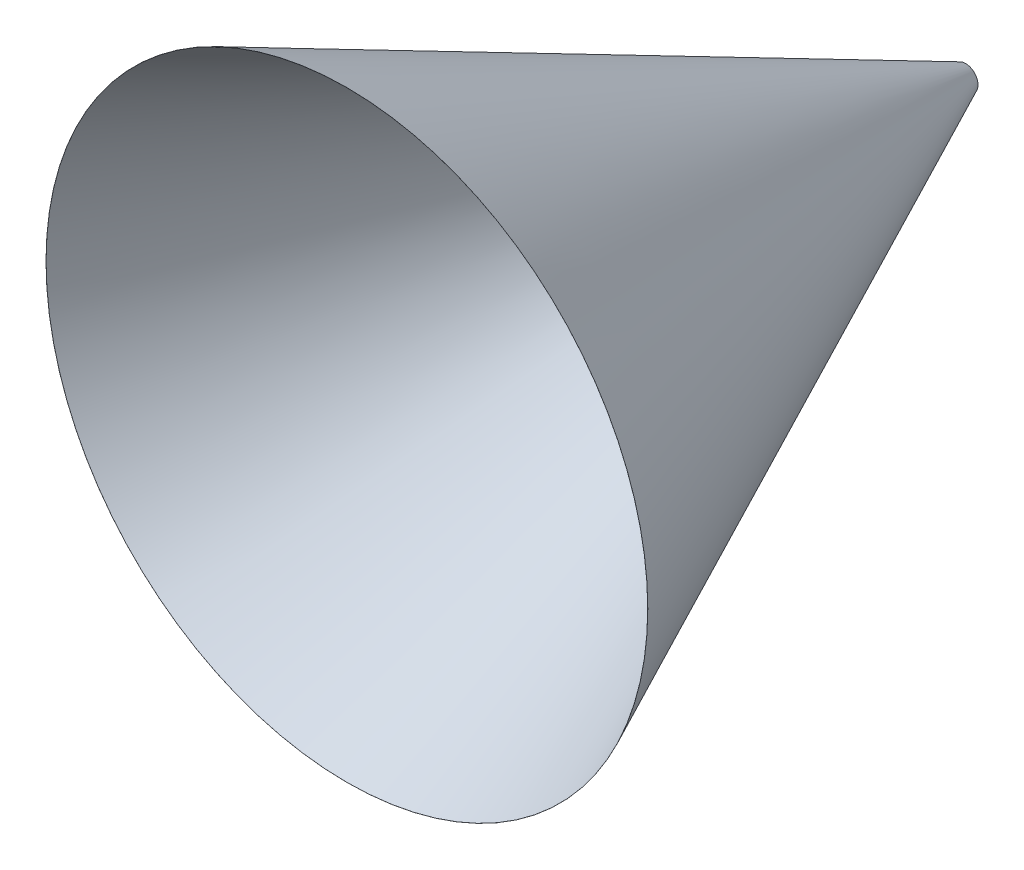
from build123d import *

# Parameters (mm, degrees)
SKETCH_1_R      = 3
EXTRUDE_1_DEPTH = 150
EXTRUDE_1_DRAFT = -25
SHELL_1_T       = -0.01


with BuildPart() as part:
    # 草图1 → 凸台-拉伸1 (with draft: the straight prism first)
    with BuildSketch(Plane.XY):
        Circle(SKETCH_1_R)
    extrude(amount=EXTRUDE_1_DEPTH)
    # 凸台-拉伸1: the draft: its side faces are tilted about the plane it starts from
    extrude_1_sides = [part.faces().sort_by_distance(p)[0] for p in [
        (-3, 0, 75),
    ]]
    draft(extrude_1_sides, Plane.XY, EXTRUDE_1_DRAFT)

    # 抽壳1
    shell_1_openings = [part.faces().sort_by_distance(p)[0] for p in [
        (0, 0, 150),
    ]]
    offset(amount=SHELL_1_T, openings=shell_1_openings, kind=Kind.INTERSECTION)


solid = part.part
